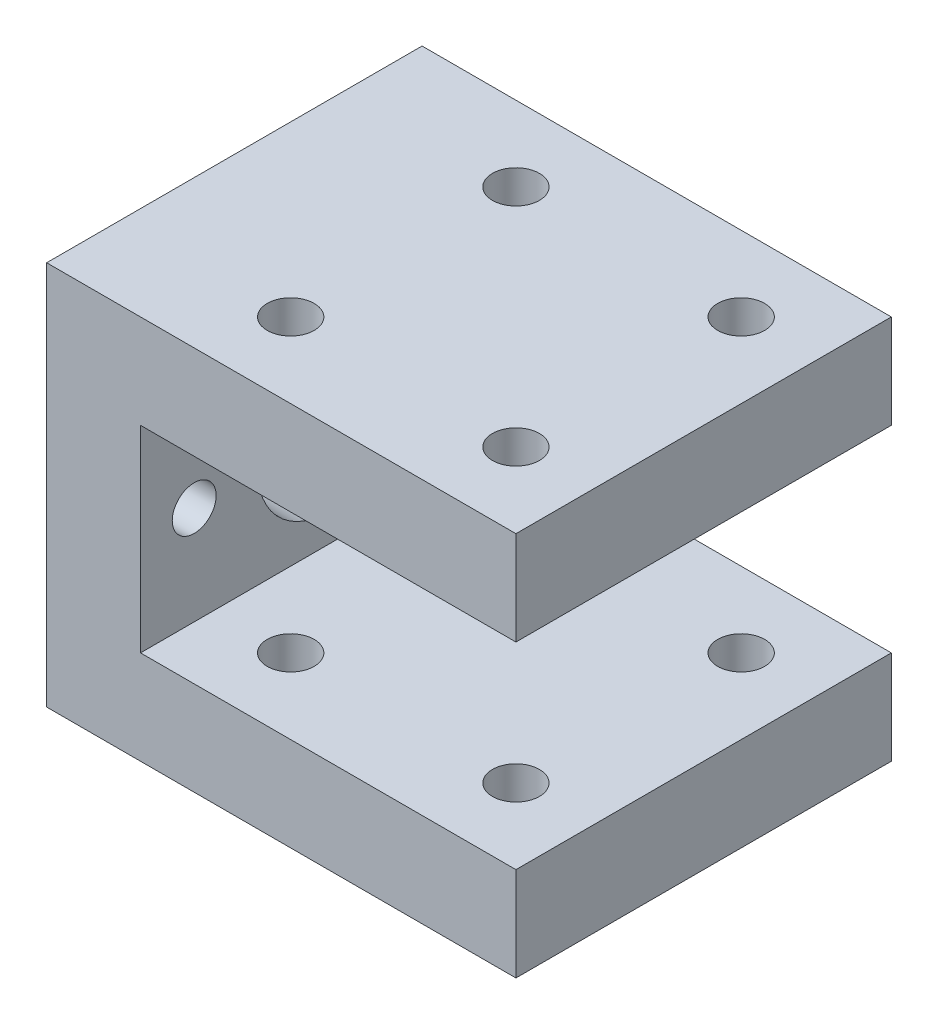
from build123d import *

# Parameters (mm, degrees)
SKETCH1_W           = 50
SKETCH1_H           = 40
BOSS_EXTRUDE1_DEPTH = 10
SKETCH2_W           = 10
SKETCH2_H           = 40
BOSS_EXTRUDE2_DEPTH = 21
SKETCH4_W           = 10
SKETCH4_H           = 40
BOSS_EXTRUDE3_DEPTH = 10
SKETCH5_W           = 40
SKETCH5_H           = 10
BOSS_EXTRUDE4_DEPTH = 40
SKETCH6_R           = 7.5
SKETCH6_R_2         = 2.5
CUT_EXTRUDE1_DEPTH  = 40
SKETCH7_R           = 2.5
CUT_EXTRUDE2_DEPTH  = 77.032887621
SKETCH8_R           = 2.5
SKETCH8_R_2         = 2.34
BOSS_EXTRUDE5_DEPTH = 10


with BuildPart() as part:
    # Sketch1 → Boss-Extrude1 (new body)
    with BuildSketch(Plane(origin=(0, 0, 0), x_dir=(1, 0, 0), z_dir=(0, 1, 0))):
        with Locations((25, 20)):
            Rectangle(SKETCH1_W, SKETCH1_H)
    extrude(amount=BOSS_EXTRUDE1_DEPTH)

    # Sketch2 → Boss-Extrude2 (add)
    with BuildSketch(Plane.XZ):
        with Locations((5, -20)):
            Rectangle(SKETCH2_W, SKETCH2_H)
    extrude(amount=BOSS_EXTRUDE2_DEPTH)

    # Sketch4 → Boss-Extrude3 (add)
    with BuildSketch(Plane.XZ.offset(21)):
        with Locations((5, -20)):
            Rectangle(SKETCH4_W, SKETCH4_H)
    extrude(amount=BOSS_EXTRUDE3_DEPTH)

    # Sketch5 → Boss-Extrude4 (add)
    with BuildSketch(Plane(origin=(10, 0, 0), x_dir=(0, 0, -1), z_dir=(1, 0, 0))):
        with Locations((20, -26)):
            Rectangle(SKETCH5_W, SKETCH5_H)
    extrude(amount=BOSS_EXTRUDE4_DEPTH)

    # Sketch6 → Cut-Extrude1 (cut)
    with BuildSketch(Plane.ZY):
        with Locations((-20, -10.5)):
            Circle(SKETCH6_R)
        with Locations((-34.28, -10.5)):
            Circle(SKETCH6_R_2)
        with Locations((-5.72, -10.5)):
            Circle(SKETCH6_R_2)
    extrude(amount=-CUT_EXTRUDE1_DEPTH, mode=Mode.SUBTRACT)

    # Sketch7 → Cut-Extrude2 (cut, through all)
    with BuildSketch(Plane.XZ.offset(31)):
        with Locations(Location((18, -8, 0), (0, 0, 270))):
            Circle(SKETCH7_R)
        with Locations(Location((42, -8, 0), (0, 0, 270))):
            Circle(SKETCH7_R)
        with Locations(Location((18, -32, 0), (0, 0, 270))):
            Circle(SKETCH7_R)
        with Locations(Location((42, -32, 0), (0, 0, 270))):
            Circle(SKETCH7_R)
    extrude(amount=-CUT_EXTRUDE2_DEPTH, mode=Mode.SUBTRACT)

    # Sketch8 → Boss-Extrude5 (add)
    # profile 1 of 2: a face of its own
    with BuildSketch(Plane.ZY):
        with Locations((-34.28, -10.5)):
            Circle(SKETCH8_R)
        with Locations((-34.28, -10.5)):
            Circle(SKETCH8_R_2, mode=Mode.SUBTRACT)
    # profile 2 of 2: a face of its own
    with BuildSketch(Plane.ZY):
        with Locations((-5.72, -10.5)):
            Circle(SKETCH8_R)
        with Locations((-5.72, -10.5)):
            Circle(SKETCH8_R_2, mode=Mode.SUBTRACT)
    extrude(amount=-BOSS_EXTRUDE5_DEPTH)


solid = part.part
